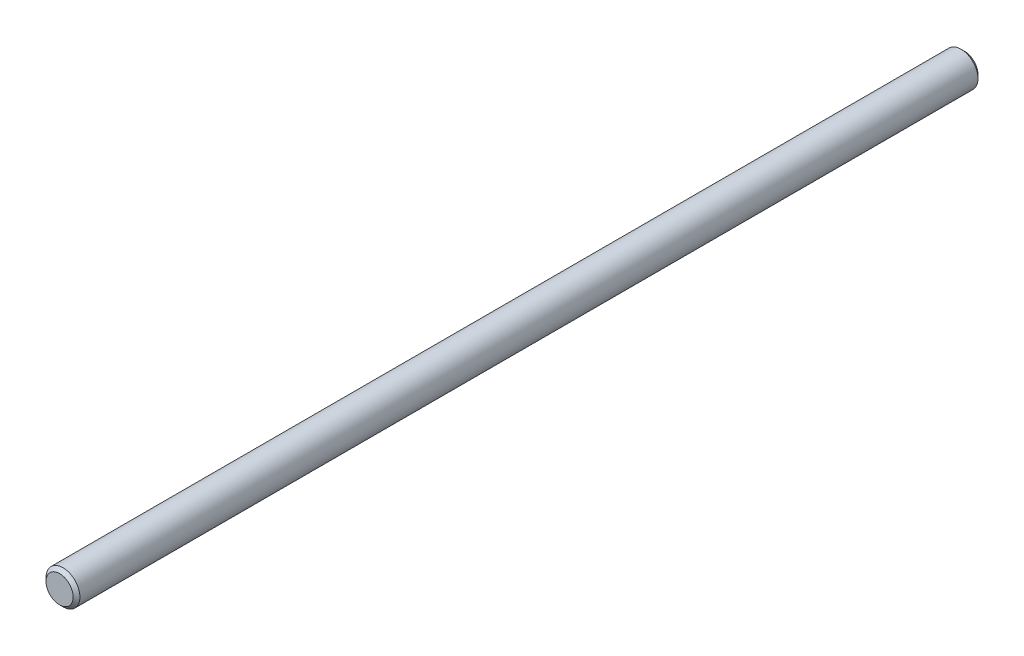
from build123d import *

# Parameters (mm, degrees)
SKETCH3_R           = 4.7625
BOSS_EXTRUDE1_DEPTH = 127
CHAMFER1_SIZE       = 0.9525


with BuildPart() as part:
    # Sketch3 → Boss-Extrude1 (new, symmetric)
    with BuildSketch(Plane.XY):
        Circle(SKETCH3_R)
    extrude(amount=BOSS_EXTRUDE1_DEPTH, both=True)

    # Chamfer1
    chamfer1_edges = [part.edges().sort_by_distance(p)[0] for p in [
        (-4.7625, 0, -127),
        (-4.7625, 0, 127),
    ]]
    chamfer(chamfer1_edges, length=CHAMFER1_SIZE)


solid = part.part
